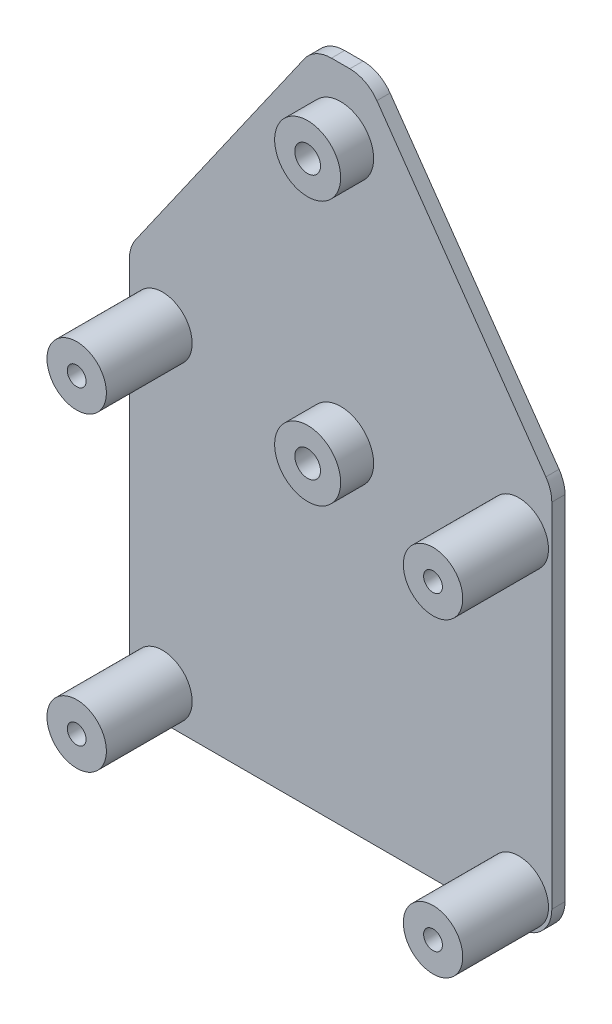
from build123d import *

# Parameters (mm, degrees)
SKETCH1_W           = 100
SKETCH1_H           = 64
SKETCH1_R           = 1.95
BOSS_EXTRUDE1_DEPTH = 2
SKETCH2_R           = 5
SKETCH2_R_2         = 1.95
BOSS_EXTRUDE2_DEPTH = 5
SKETCH3_R           = 4.5
SKETCH3_R_2         = 1.425
BOSS_EXTRUDE3_DEPTH = 13
CUT_EXTRUDE1_DEPTH  = 120.436175424
FILLET1_R           = 5


with BuildPart() as part:
    # Sketch1 → Boss-Extrude1 (new body)
    with BuildSketch(Plane(origin=(0, 0, 0), x_dir=(0, 1, 0), z_dir=(0, 0, 1))):
        with Locations((50, 32)):
            Rectangle(SKETCH1_W, SKETCH1_H)
        with Locations(Location((90, 32, 0), (0, 0, 270))):
            Circle(SKETCH1_R, mode=Mode.SUBTRACT)
        with Locations(Location((50, 32, 0), (0, 0, 270))):
            Circle(SKETCH1_R, mode=Mode.SUBTRACT)
    extrude(amount=BOSS_EXTRUDE1_DEPTH)

    # Sketch2 → Boss-Extrude2 (add)
    # profile 1 of 2: a face of its own
    with BuildSketch(Plane.XY.offset(2)):
        with Locations((-32, 50)):
            Circle(SKETCH2_R)
        with Locations((-32, 50)):
            Circle(SKETCH2_R_2, mode=Mode.SUBTRACT)
    # profile 2 of 2: a face of its own
    with BuildSketch(Plane.XY.offset(2)):
        with Locations((-32, 90)):
            Circle(SKETCH2_R)
        with Locations((-32, 90)):
            Circle(SKETCH2_R_2, mode=Mode.SUBTRACT)
    extrude(amount=BOSS_EXTRUDE2_DEPTH)

    # Sketch3 → Boss-Extrude3 (add)
    # profile 1 of 4: a face of its own
    with BuildSketch(Plane.XY.offset(2)):
        with Locations(Location((-59, 5, 0), (0, 0, 180))):
            Circle(SKETCH3_R)
        with Locations(Location((-59, 5, 0), (0, 0, 180))):
            Circle(SKETCH3_R_2, mode=Mode.SUBTRACT)
    # profile 2 of 4: a face of its own
    with BuildSketch(Plane.XY.offset(2)):
        with Locations(Location((-5, 5, 0), (0, 0, 180))):
            Circle(SKETCH3_R)
        with Locations(Location((-5, 5, 0), (0, 0, 180))):
            Circle(SKETCH3_R_2, mode=Mode.SUBTRACT)
    # profile 3 of 4: a face of its own
    with BuildSketch(Plane.XY.offset(2)):
        with Locations(Location((-5, 52, 0), (0, 0, 180))):
            Circle(SKETCH3_R)
        with Locations(Location((-5, 52, 0), (0, 0, 180))):
            Circle(SKETCH3_R_2, mode=Mode.SUBTRACT)
    # profile 4 of 4: a face of its own
    with BuildSketch(Plane.XY.offset(2)):
        with Locations(Location((-59, 52, 0), (0, 0, 180))):
            Circle(SKETCH3_R)
        with Locations(Location((-59, 52, 0), (0, 0, 180))):
            Circle(SKETCH3_R_2, mode=Mode.SUBTRACT)
    extrude(amount=BOSS_EXTRUDE3_DEPTH)

    # Sketch4 → Cut-Extrude1 (cut, through all)
    with BuildSketch(Plane.XY.offset(2)):
        Polygon((-64, 100), (-36, 100), (-64, 60), align=None)
        Polygon((-28, 100), (0, 100), (0, 60), align=None)
    extrude(amount=-CUT_EXTRUDE1_DEPTH, mode=Mode.SUBTRACT)

    # Fillet1
    fillet1_edges = [part.edges().sort_by_distance(p)[0] for p in [
        (-64, 60, 1),
        (-36, 100, 1),
        (-64, 0, 1),
        (0, 60, 1),
        (-28, 100, 1),
        (0, 0, 1),
    ]]
    fillet(fillet1_edges, radius=FILLET1_R)


solid = part.part
